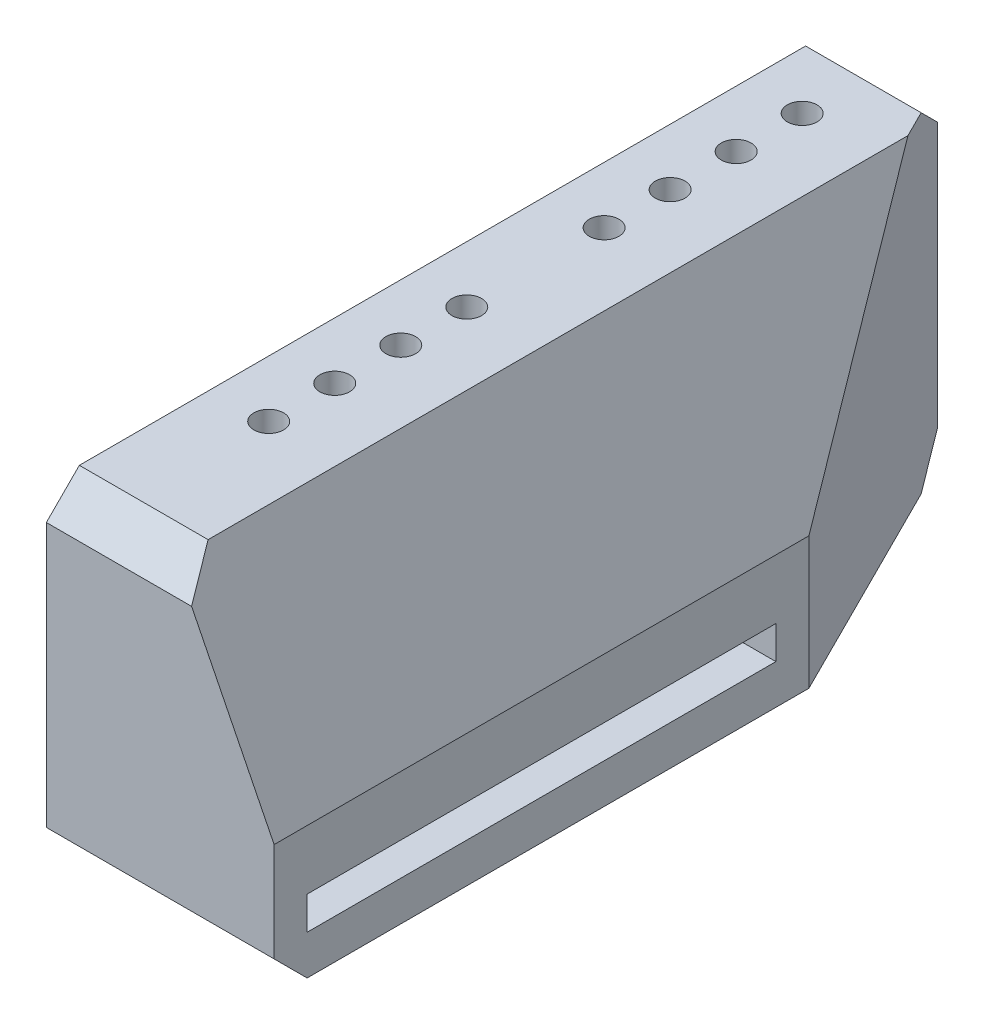
from build123d import *

# Parameters (mm, degrees)
SKETCH1_W                     = 120
SKETCH1_H                     = 50
BOSS_EXTRUDE1_DEPTH           = 34.5
SKETCH2_W                     = 71
SKETCH2_H                     = 5
CUT_EXTRUDE1_DEPTH            = 16
M4_CLEARANCE_HOLE1_D          = 4.5
M4_CLEARANCE_HOLE1_DEPTH      = 6
M4_CLEARANCE_HOLE2_AT_2_COUNT = 2
M4_CLEARANCE_HOLE2_AT_2_PITCH = 50.8
LPATTERN1_COUNT               = 4
LPATTERN1_PITCH               = 10
SKETCH9_W                     = 41
SKETCH9_H                     = 5
CUT_EXTRUDE2_DEPTH            = 16
CUT_EXTRUDE3_DEPTH            = 86.382960829
CHAMFER2_SIZE                 = 15
CHAMFER2_SIZE2                = 30
CHAMFER3_SIZE                 = 5


with BuildPart() as part:
    # Sketch1 → Boss-Extrude1 (new body)
    with BuildSketch(Plane(origin=(0, 0, 0), x_dir=(0, 0, -1), z_dir=(1, 0, 0))):
        Rectangle(SKETCH1_W, SKETCH1_H)
    extrude(amount=BOSS_EXTRUDE1_DEPTH)

    # Sketch2 → Cut-Extrude1 (cut)
    with BuildSketch(Plane(origin=(34.5, 0, 0), x_dir=(0, 0, -1), z_dir=(1, 0, 0))):
        with Locations((-19.5, -16.5)):
            Rectangle(SKETCH2_W, SKETCH2_H)
    extrude(amount=-CUT_EXTRUDE1_DEPTH, mode=Mode.SUBTRACT)

    # M4 Clearance Hole1
    with Locations(Plane(origin=(0, -25, 0), x_dir=(-1, 0, 0), z_dir=(0, -1, 0))):
        with Locations((-24.5, -50), (-24.5, 10)):
            Hole(M4_CLEARANCE_HOLE1_D / 2, depth=M4_CLEARANCE_HOLE1_DEPTH)

    # Sketch8 → M4 Clearance Hole2 (revolve, cut)
    with BuildSketch(Plane(origin=(8.58, 25, -15.9), x_dir=(0, 0, 1), z_dir=(1, 0, 0))):
        Polygon((0, 0), (0, 7.351936393), (2.25, 6), (2.25, 0), align=None)
    m4_clearance_hole2 = revolve(axis=Axis((8.58, 31.35, -15.9), (0, -1, 0)), mode=Mode.SUBTRACT)

    # M4 Clearance Hole2 at 2: M4 Clearance Hole2 ×2
    with Locations(*[(0, 0, i * M4_CLEARANCE_HOLE2_AT_2_PITCH) for i in range(1, M4_CLEARANCE_HOLE2_AT_2_COUNT)]):
        add(m4_clearance_hole2, mode=Mode.SUBTRACT)

    # LPattern1: M4 Clearance Hole2 ×4
    with Locations(*[(0, 0, -i * LPATTERN1_PITCH) for i in range(1, LPATTERN1_COUNT)]):
        add(m4_clearance_hole2, mode=Mode.SUBTRACT)

    # LPattern1 copy 1 sketch → LPattern1 copy 1 (revolve, cut)
    with BuildSketch(Plane(origin=(8.58, 25, 24.9), x_dir=(0, 0, 1), z_dir=(1, 0, 0))):
        Polygon((0, 0), (0, 7.351936393), (2.25, 6), (2.25, 0), align=None)
    revolve(axis=Axis((8.58, 31.35, 24.9), (0, -1, 0)), mode=Mode.SUBTRACT)

    # LPattern1 copy 2 sketch → LPattern1 copy 2 (revolve, cut)
    with BuildSketch(Plane(origin=(8.58, 25, 14.9), x_dir=(0, 0, 1), z_dir=(1, 0, 0))):
        Polygon((0, 0), (0, 7.351936393), (2.25, 6), (2.25, 0), align=None)
    revolve(axis=Axis((8.58, 31.35, 14.9), (0, -1, 0)), mode=Mode.SUBTRACT)

    # LPattern1 copy 3 sketch → LPattern1 copy 3 (revolve, cut)
    with BuildSketch(Plane(origin=(8.58, 25, 4.9), x_dir=(0, 0, 1), z_dir=(1, 0, 0))):
        Polygon((0, 0), (0, 7.351936393), (2.25, 6), (2.25, 0), align=None)
    revolve(axis=Axis((8.58, 31.35, 4.9), (0, -1, 0)), mode=Mode.SUBTRACT)

    # Sketch9 → Cut-Extrude2 (cut)
    with BuildSketch(Plane.ZY):
        with Locations((-30.9, 16.5)):
            Rectangle(SKETCH9_W, SKETCH9_H)
        with Locations((19.9, 16.5)):
            Rectangle(SKETCH9_W, SKETCH9_H)
    extrude(amount=-CUT_EXTRUDE2_DEPTH, mode=Mode.SUBTRACT)

    # Sketch10 → Cut-Extrude3 (cut, through all)
    with BuildSketch(Plane(origin=(0, 25, 0), x_dir=(1, 0, 0), z_dir=(0, 1, 0))):
        Polygon((34.5, 60), (15, 60), (34.5, 21), align=None)
    extrude(amount=-CUT_EXTRUDE3_DEPTH, mode=Mode.SUBTRACT)

    # Chamfer2
    chamfer2_edges = [part.edges().sort_by_distance(p)[0] for p in [
        (34.5, 25, 19.5),
    ]]
    chamfer2_side = [part.faces().sort_by_distance(p)[0] for p in [
        (16.428375325, 25, 5.112583766),
    ]]
    chamfer(chamfer2_edges, length=CHAMFER2_SIZE, length2=CHAMFER2_SIZE2, reference=chamfer2_side[0])

    # Chamfer3
    chamfer3_edges = [part.edges().sort_by_distance(p)[0] for p in [
        (7.5, 25, -60),
        (7.5, -25, -60),
        (9.75, 25, 60),
        (17.25, -25, 60),
    ]]
    chamfer(chamfer3_edges, length=CHAMFER3_SIZE)


solid = part.part
